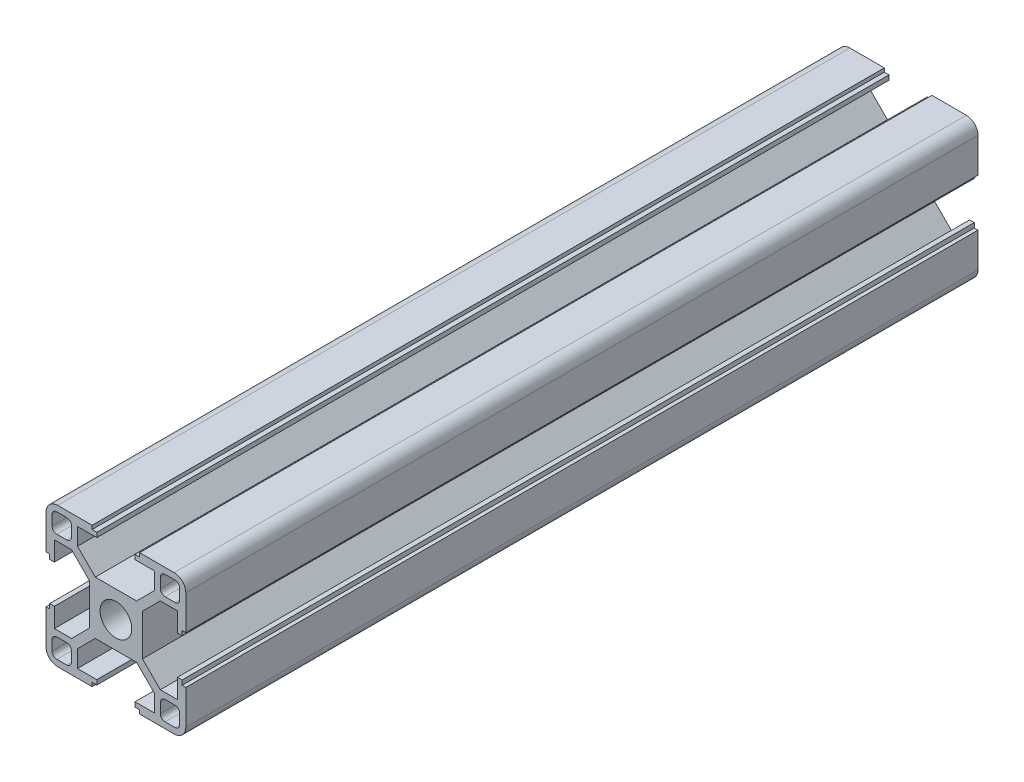
from build123d import *

# Parameters (mm, degrees)
SKETCH1_R      = 3.4
EXTRUDE1_DEPTH = 170
EXTRUDE2_DEPTH = 172.31841699


with BuildPart() as part:
    # Sketch1 → Extrude1 (new body)
    with BuildSketch(Plane.XY):
        with BuildLine():
            Line((-5.1, 14.2), (-5.1, 15))
            Line((-5.1, 15), (-12.5, 15))
            ThreePointArc((-12.5, 15), (-14.267766953, 14.267766953), (-15, 12.5))
            Line((-15, 12.5), (-15, 5.1))
            Line((-15, 5.1), (-14.2, 5.1))
            Line((-14.2, 5.1), (-14.2, 4.1))
            Line((-14.2, 4.1), (-13.2, 4.1))
            Line((-13.2, 4.1), (-13.2, 8.25))
            Line((-13.2, 8.25), (-9.522792206, 8.25))
            Line((-9.522792206, 8.25), (-5.7, 4.427207794))
            Line((-5.7, 4.427207794), (-5.7, -4.427207794))
            Line((-5.7, -4.427207794), (-9.522792206, -8.25))
            Line((-9.522792206, -8.25), (-13.2, -8.25))
            Line((-13.2, -8.25), (-13.2, -4.1))
            Line((-13.2, -4.1), (-14.2, -4.1))
            Line((-14.2, -4.1), (-14.2, -5.1))
            Line((-14.2, -5.1), (-15, -5.1))
            Line((-15, -5.1), (-15, -12.5))
            ThreePointArc((-15, -12.5), (-14.267766953, -14.267766953), (-12.5, -15))
            Line((-12.5, -15), (-5.1, -15))
            Line((-5.1, -15), (-5.1, -14.2))
            Line((-5.1, -14.2), (-4.1, -14.2))
            Line((-4.1, -14.2), (-4.1, -13.2))
            Line((-4.1, -13.2), (-8.25, -13.2))
            Line((-8.25, -13.2), (-8.25, -9.522792206))
            Line((-8.25, -9.522792206), (-4.427207794, -5.7))
            Line((-4.427207794, -5.7), (4.427207794, -5.7))
            Line((4.427207794, -5.7), (8.25, -9.522792206))
            Line((8.25, -9.522792206), (8.25, -13.2))
            Line((8.25, -13.2), (4.1, -13.2))
            Line((4.1, -13.2), (4.1, -14.2))
            Line((4.1, -14.2), (5.1, -14.2))
            Line((5.1, -14.2), (5.1, -15))
            Line((5.1, -15), (12.5, -15))
            ThreePointArc((12.5, -15), (14.267766953, -14.267766953), (15, -12.5))
            Line((15, -12.5), (15, -5.1))
            Line((15, -5.1), (14.2, -5.1))
            Line((14.2, -5.1), (14.2, -4.1))
            Line((14.2, -4.1), (13.2, -4.1))
            Line((13.2, -4.1), (13.2, -8.25))
            Line((13.2, -8.25), (9.522792206, -8.25))
            Line((9.522792206, -8.25), (5.7, -4.427207794))
            Line((5.7, -4.427207794), (5.7, 4.427207794))
            Line((5.7, 4.427207794), (9.522792206, 8.25))
            Line((9.522792206, 8.25), (13.2, 8.25))
            Line((13.2, 8.25), (13.2, 4.1))
            Line((13.2, 4.1), (14.2, 4.1))
            Line((14.2, 4.1), (14.2, 5.1))
            Line((14.2, 5.1), (15, 5.1))
            Line((15, 5.1), (15, 12.5))
            ThreePointArc((15, 12.5), (14.267766953, 14.267766953), (12.5, 15))
            Line((12.5, 15), (5.1, 15))
            Line((5.1, 15), (5.1, 14.2))
            Line((5.1, 14.2), (4.1, 14.2))
            Line((4.1, 14.2), (4.1, 13.2))
            Line((4.1, 13.2), (8.25, 13.2))
            Line((8.25, 13.2), (8.25, 9.522792206))
            Line((8.25, 9.522792206), (4.427207794, 5.7))
            Line((4.427207794, 5.7), (-4.427207794, 5.7))
            Line((-4.427207794, 5.7), (-8.25, 9.522792206))
            Line((-8.25, 9.522792206), (-8.25, 13.2))
            Line((-8.25, 13.2), (-4.1, 13.2))
            Line((-4.1, 13.2), (-4.1, 14.2))
            Line((-4.1, 14.2), (-5.1, 14.2))
        make_face()
        Circle(SKETCH1_R, mode=Mode.SUBTRACT)
    extrude(amount=EXTRUDE1_DEPTH)

    # Sketch2 → Extrude2 (cut, through all)
    with BuildSketch(Plane.XY.offset(170)):
        with BuildLine():
            Line((13.7, 12.7), (13.7, 10.55))
            ThreePointArc((13.7, 10.55), (13.407106781, 9.842893219), (12.7, 9.55))
            Line((12.7, 9.55), (10.55, 9.55))
            ThreePointArc((10.55, 9.55), (9.842893219, 9.842893219), (9.55, 10.55))
            Line((9.55, 10.55), (9.55, 12.7))
            ThreePointArc((9.55, 12.7), (9.842893219, 13.407106781), (10.55, 13.7))
            Line((10.55, 13.7), (12.7, 13.7))
            ThreePointArc((12.7, 13.7), (13.407106781, 13.407106781), (13.7, 12.7))
        make_face()
        with BuildLine():
            Line((-12.7, 13.7), (-10.55, 13.7))
            ThreePointArc((-10.55, 13.7), (-9.842893219, 13.407106781), (-9.55, 12.7))
            Line((-9.55, 12.7), (-9.55, 10.55))
            ThreePointArc((-9.55, 10.55), (-9.842893219, 9.842893219), (-10.55, 9.55))
            Line((-10.55, 9.55), (-12.7, 9.55))
            ThreePointArc((-12.7, 9.55), (-13.407106781, 9.842893219), (-13.7, 10.55))
            Line((-13.7, 10.55), (-13.7, 12.7))
            ThreePointArc((-13.7, 12.7), (-13.407106781, 13.407106781), (-12.7, 13.7))
        make_face()
        with BuildLine():
            Line((12.7, -13.7), (10.55, -13.7))
            ThreePointArc((10.55, -13.7), (9.842893219, -13.407106781), (9.55, -12.7))
            Line((9.55, -12.7), (9.55, -10.55))
            ThreePointArc((9.55, -10.55), (9.842893219, -9.842893219), (10.55, -9.55))
            Line((10.55, -9.55), (12.7, -9.55))
            ThreePointArc((12.7, -9.55), (13.407106781, -9.842893219), (13.7, -10.55))
            Line((13.7, -10.55), (13.7, -12.7))
            ThreePointArc((13.7, -12.7), (13.407106781, -13.407106781), (12.7, -13.7))
        make_face()
        with BuildLine():
            Line((-13.7, -12.7), (-13.7, -10.55))
            ThreePointArc((-13.7, -10.55), (-13.407106781, -9.842893219), (-12.7, -9.55))
            Line((-12.7, -9.55), (-10.55, -9.55))
            ThreePointArc((-10.55, -9.55), (-9.842893219, -9.842893219), (-9.55, -10.55))
            Line((-9.55, -10.55), (-9.55, -12.7))
            ThreePointArc((-9.55, -12.7), (-9.842893219, -13.407106781), (-10.55, -13.7))
            Line((-10.55, -13.7), (-12.7, -13.7))
            ThreePointArc((-12.7, -13.7), (-13.407106781, -13.407106781), (-13.7, -12.7))
        make_face()
    extrude(amount=-EXTRUDE2_DEPTH, mode=Mode.SUBTRACT)


solid = part.part
